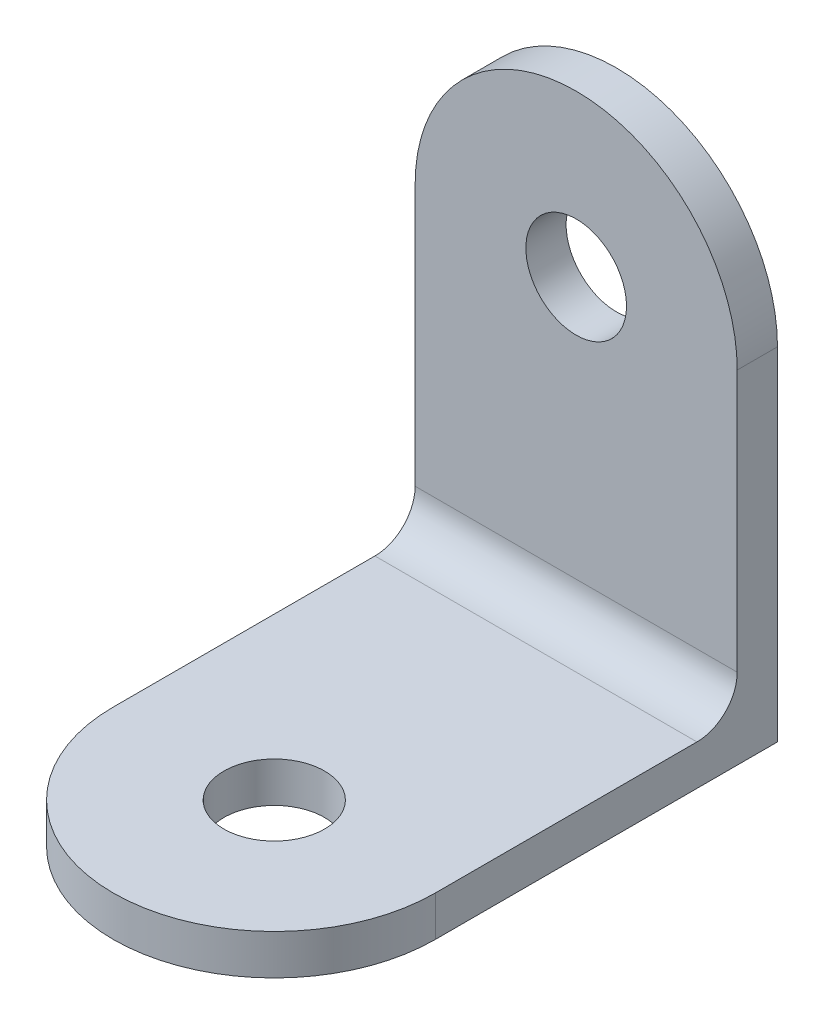
from build123d import *

# Parameters (mm, degrees)
EXTRUDE_1_DEPTH     = 16
EXTRUDE_2_DEPTH     = 2
FILLET_1_R          = 2
EXTRUDE_3_DEPTH     = 2
SKETCH_4_R          = 2.5
CUT_EXTRUDE_1_DEPTH = 16
SKETCH_5_R          = 2.5
CUT_EXTRUDE_2_DEPTH = 16


with BuildPart() as part:
    # 草图1 → 凸台-拉伸1 (new body)
    with BuildSketch(Plane(origin=(0, 0, 0), x_dir=(0, 0, -1), z_dir=(1, 0, 0))):
        Polygon((0, 0), (17, 0), (17, 17), (15, 17), (15, 2), (0, 2), align=None)
    extrude(amount=EXTRUDE_1_DEPTH)

    # 草图2 → 凸台-拉伸2 (add)
    with BuildSketch(Plane.XY.offset(-15)):
        with BuildLine():
            Line((0, 17), (16, 17))
            ThreePointArc((16, 17), (8, 25), (0, 17))
        make_face()
    extrude(amount=-EXTRUDE_2_DEPTH)

    # 圆角1
    fillet_1_edges = [part.edges().sort_by_distance(p)[0] for p in [
        (8, 2, -15),
    ]]
    fillet(fillet_1_edges, radius=FILLET_1_R)

    # 草图3 → 凸台-拉伸3 (add)
    with BuildSketch(Plane(origin=(0, 2, 0), x_dir=(1, 0, 0), z_dir=(0, 1, 0))):
        with BuildLine():
            Line((0, 0), (16, 0))
            ThreePointArc((16, 0), (8, -8), (0, 0))
        make_face()
    extrude(amount=-EXTRUDE_3_DEPTH)

    # 草图4 → 切除-拉伸1 (cut)
    with BuildSketch(Plane.XY.offset(-15)):
        with Locations((8, 17)):
            Circle(SKETCH_4_R)
    extrude(amount=-CUT_EXTRUDE_1_DEPTH, mode=Mode.SUBTRACT)

    # 草图5 → 切除-拉伸2 (cut)
    with BuildSketch(Plane(origin=(0, 2, 0), x_dir=(1, 0, 0), z_dir=(0, 1, 0))):
        with Locations(Location((8, 0, 0), (0, 0, 270))):
            Circle(SKETCH_5_R)
    extrude(amount=-CUT_EXTRUDE_2_DEPTH, mode=Mode.SUBTRACT)


solid = part.part
